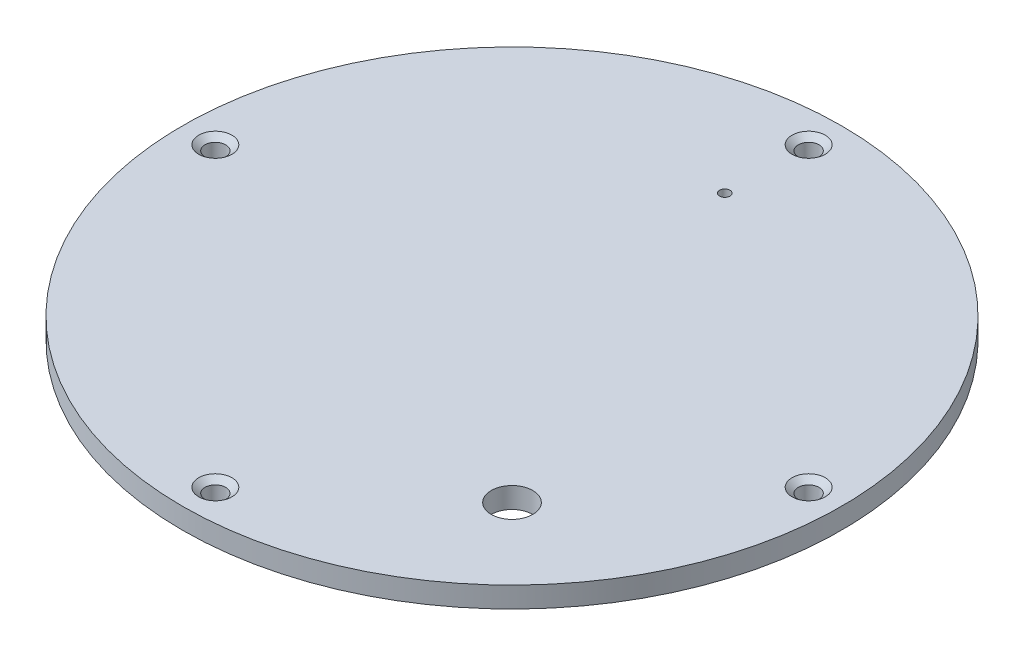
from build123d import *

# Parameters (mm, degrees)
SKETCH1_R                                       = 15.875
BOSS_EXTRUDE1_DEPTH                             = 1
CSK_FOR_M2_FLAT_HEAD_MACHINE_SCREW1_D           = 1
CSK_FOR_M2_FLAT_HEAD_MACHINE_SCREW1_CSINK_D     = 1.6
CSK_FOR_M2_FLAT_HEAD_MACHINE_SCREW1_CSINK_ANGLE = 100
CUT_EXTRUDE1_DEPTH                              = 23.472900347
CUT_EXTRUDE1_DEPTH_BACK                         = 23.472900347
SKETCH4_R                                       = 0.25
CUT_EXTRUDE2_DEPTH                              = 23.472900347
CUT_EXTRUDE2_DEPTH_BACK                         = 23.472900347
SKETCH5_R                                       = 1


with BuildPart() as part:
    # Sketch1 → Boss-Extrude1 (new body)
    with BuildSketch(Plane(origin=(0, 0, 0), x_dir=(1, 0, 0), z_dir=(0, 1, 0))):
        with Locations(Location((0, 0, 0), (0, 0, 270))):
            Circle(SKETCH1_R)
    extrude(amount=BOSS_EXTRUDE1_DEPTH)

    # CSK for M2 Flat Head Machine Screw1 (through all)
    with Locations(Plane(origin=(0, 1, 0), x_dir=(1, 0, 0), z_dir=(0, 1, 0))):
        with Locations((0, 14.29), (14.29, 0), (0, -14.29), (-14.29, 0)):
            CounterSinkHole(CSK_FOR_M2_FLAT_HEAD_MACHINE_SCREW1_D / 2, CSK_FOR_M2_FLAT_HEAD_MACHINE_SCREW1_CSINK_D / 2, counter_sink_angle=CSK_FOR_M2_FLAT_HEAD_MACHINE_SCREW1_CSINK_ANGLE)

    # Sketch4 → Cut-Extrude1 (cut, two sides: drawn at the far end of the back side and taken through both)
    with BuildSketch(Plane(origin=(0, 1, 0), x_dir=(1, 0, 0), z_dir=(0, 1, 0)).offset(-CUT_EXTRUDE1_DEPTH_BACK)):
        with Locations(Location((0, 10.25, 0), (0, 0, 270))):
            Circle(SKETCH4_R)
    extrude(amount=CUT_EXTRUDE1_DEPTH + CUT_EXTRUDE1_DEPTH_BACK, mode=Mode.SUBTRACT)

    # Sketch5 → Cut-Extrude2 (cut, two sides: drawn at the far end of the back side and taken through both)
    with BuildSketch(Plane.XZ.offset(-CUT_EXTRUDE2_DEPTH_BACK)):
        with Locations(Location((7.778174593, 7.778174593, 0), (0, 0, 270))):
            Circle(SKETCH5_R)
    extrude(amount=CUT_EXTRUDE2_DEPTH + CUT_EXTRUDE2_DEPTH_BACK, mode=Mode.SUBTRACT)


solid = part.part
